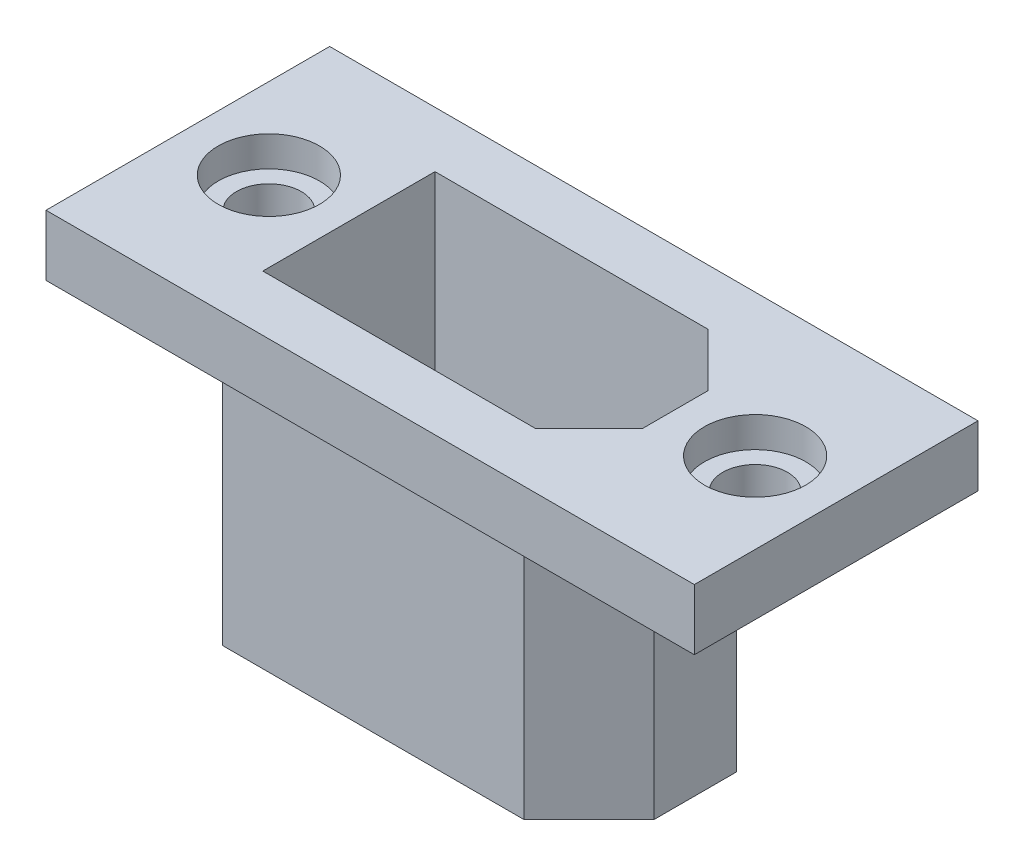
from build123d import *

# Parameters (mm, degrees)
SKETCH1_W           = 32
SKETCH1_H           = 14
BOSS_EXTRUDE1_DEPTH = 3
CUT_EXTRUDE1_DEPTH  = 3
BOSS_EXTRUDE2_DEPTH = 16
SKETCH4_R           = 1.6
CUT_EXTRUDE2_DEPTH  = 3
SKETCH5_R           = 2.5
CUT_EXTRUDE3_DEPTH  = 1.5


with BuildPart() as part:
    # Sketch1 → Boss-Extrude1 (new body)
    with BuildSketch(Plane(origin=(0, 0, 0), x_dir=(1, 0, 0), z_dir=(0, 1, 0))):
        Rectangle(SKETCH1_W, SKETCH1_H)
    extrude(amount=BOSS_EXTRUDE1_DEPTH)

    # Sketch2 → Cut-Extrude1 (cut)
    with BuildSketch(Plane(origin=(0, 3, 0), x_dir=(1, 0, 0), z_dir=(0, 1, 0))):
        Polygon((5.424264069, -4.25), (-8.05, -4.25), (-8.05, 4.25), (5.424264069, 4.25), (8.05, 1.624264069), (8.05, -1.624264069), align=None)
    extrude(amount=-CUT_EXTRUDE1_DEPTH, mode=Mode.SUBTRACT)

    # Sketch3 → Boss-Extrude2 (add)
    with BuildSketch(Plane(origin=(0, 3, 0), x_dir=(1, 0, 0), z_dir=(0, 1, 0))):
        Polygon((5.838477631, -5.25), (-9.05, -5.25), (-9.05, 5.25), (5.838477631, 5.25), (9.05, 2.038477631), (9.05, -2.038477631), align=None)
        Polygon((-8.05, -4.25), (-8.05, 4.25), (5.424264069, 4.25), (8.05, 1.624264069), (8.05, -1.624264069), (5.424264069, -4.25), align=None, mode=Mode.SUBTRACT)
    extrude(amount=-BOSS_EXTRUDE2_DEPTH)

    # Sketch4 → Cut-Extrude2 (cut)
    with BuildSketch(Plane(origin=(0, 3, 0), x_dir=(1, 0, 0), z_dir=(0, 1, 0))):
        with Locations(Location((-12, 0, 0), (0, 0, 270))):
            Circle(SKETCH4_R)
        with Locations(Location((12, 0, 0), (0, 0, 270))):
            Circle(SKETCH4_R)
    extrude(amount=-CUT_EXTRUDE2_DEPTH, mode=Mode.SUBTRACT)

    # Sketch5 → Cut-Extrude3 (cut)
    with BuildSketch(Plane(origin=(0, 3, 0), x_dir=(1, 0, 0), z_dir=(0, 1, 0))):
        with Locations(Location((-12, 0, 0), (0, 0, 270))):
            Circle(SKETCH5_R)
        with Locations(Location((12, 0, 0), (0, 0, 270))):
            Circle(SKETCH5_R)
    extrude(amount=-CUT_EXTRUDE3_DEPTH, mode=Mode.SUBTRACT)


solid = part.part
